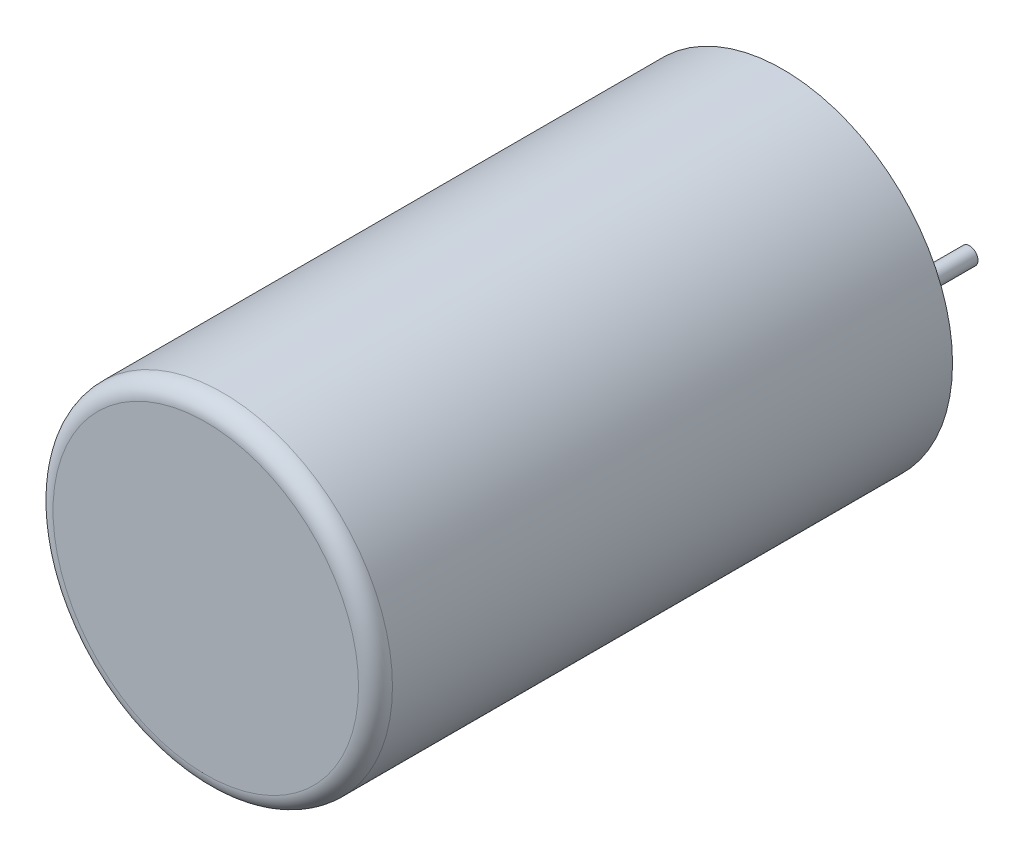
from build123d import *

# Parameters (mm, degrees)
SKETCH_1_R      = 5
EXTRUDE_1_DEPTH = 17
SKETCH_2_R      = 0.25
EXTRUDE_2_DEPTH = 3
FILLET_1_R      = 0.5


with BuildPart() as part:
    # Эскиз1 → Вытянуть1 (new body)
    with BuildSketch(Plane.XY):
        Circle(SKETCH_1_R)
    extrude(amount=EXTRUDE_1_DEPTH)

    # Эскиз2 → Вытянуть2 (add)
    with BuildSketch(Plane(origin=(0, 0, 0), x_dir=(-1, 0, 0), z_dir=(0, 0, -1))):
        with Locations(Location((-2.5, 0, 0), (0, 0, 180))):
            Circle(SKETCH_2_R)
        with Locations(Location((2.5, 0, 0), (0, 0, 180))):
            Circle(SKETCH_2_R)
    extrude(amount=EXTRUDE_2_DEPTH)

    # Скругление1
    fillet_1_edges = [part.edges().sort_by_distance(p)[0] for p in [
        (-5, 0, 17),
    ]]
    fillet(fillet_1_edges, radius=FILLET_1_R)


solid = part.part
